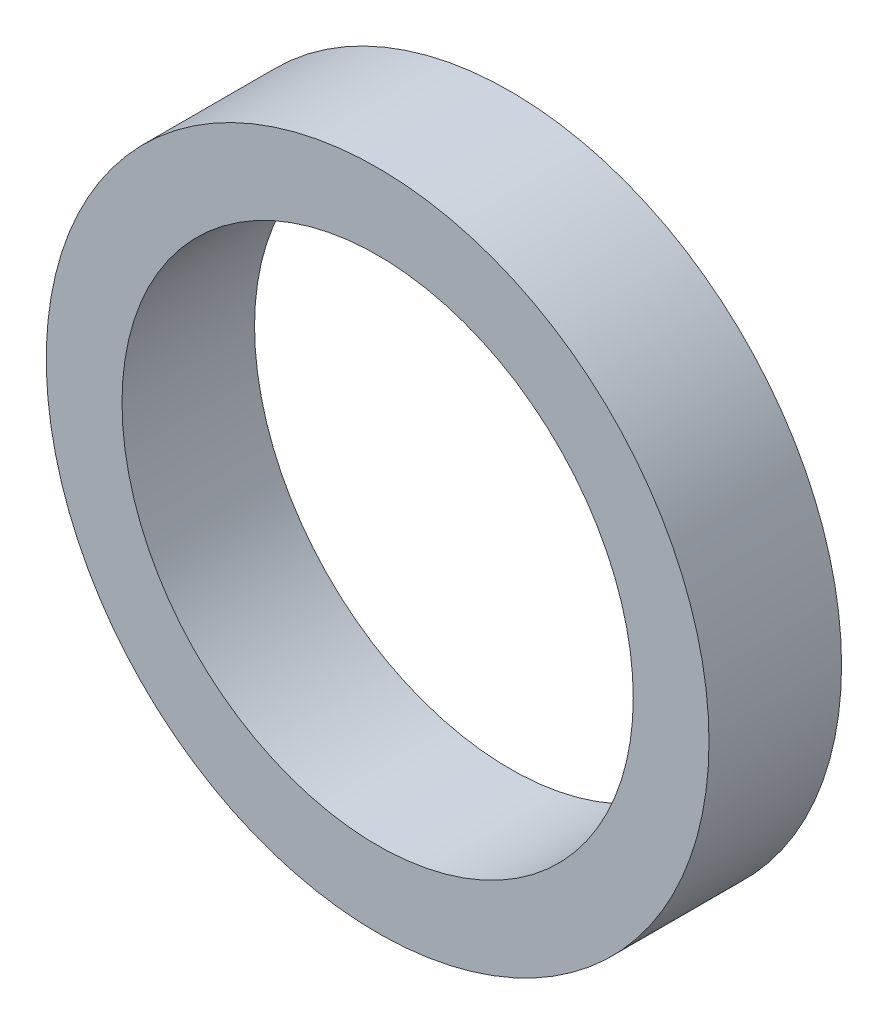
from build123d import *

# Parameters (mm, degrees)
SKETCH_1_R      = 7
SKETCH_1_R_2    = 5.4
EXTRUDE_1_DEPTH = 1.4


with BuildPart() as part:
    # ｽｹｯﾁ1 → ﾎﾞｽ - 押し出し1 (new, symmetric)
    with BuildSketch(Plane.XY):
        Circle(SKETCH_1_R)
        Circle(SKETCH_1_R_2, mode=Mode.SUBTRACT)
    extrude(amount=EXTRUDE_1_DEPTH, both=True)


solid = part.part
